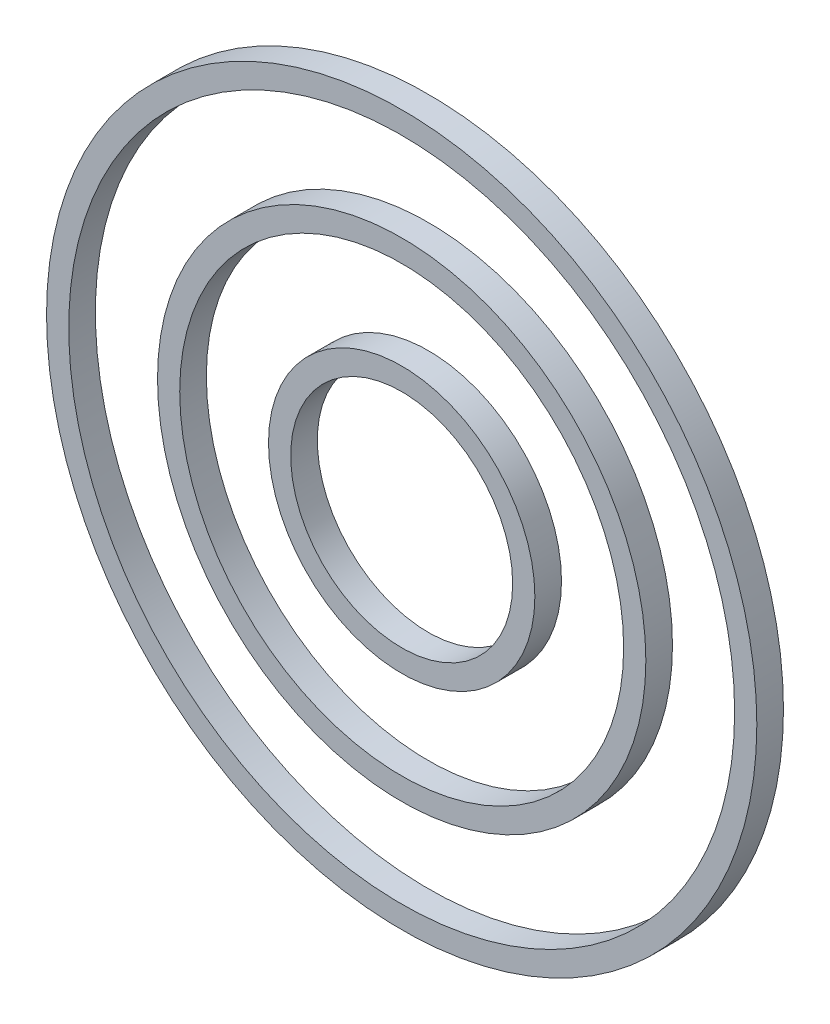
from build123d import *

# Parameters (mm, degrees)
SKETCH1_R             = 40
SKETCH1_R_2           = 37.5
BOSS_EXTRUDE1_DEPTH   = 3
SKETCH1_R_3           = 27.5
SKETCH1_R_4           = 25
BOSS_EXTRUDE1_2_DEPTH = 3
SKETCH1_R_5           = 15
SKETCH1_R_6           = 12.5
BOSS_EXTRUDE1_3_DEPTH = 3


with BuildPart() as part:
    # Sketch1 → Boss-Extrude1 (new body)
    with BuildSketch(Plane.XY):
        Circle(SKETCH1_R)
        Circle(SKETCH1_R_2, mode=Mode.SUBTRACT)
    extrude(amount=BOSS_EXTRUDE1_DEPTH)


with BuildPart() as body_2:
    # Sketch1 → Boss-Extrude1 2 (new body)
    with BuildSketch(Plane.XY):
        Circle(SKETCH1_R_3)
        Circle(SKETCH1_R_4, mode=Mode.SUBTRACT)
    extrude(amount=BOSS_EXTRUDE1_2_DEPTH)


with BuildPart() as body_3:
    # Sketch1 → Boss-Extrude1 3 (new body)
    with BuildSketch(Plane.XY):
        Circle(SKETCH1_R_5)
        Circle(SKETCH1_R_6, mode=Mode.SUBTRACT)
    extrude(amount=BOSS_EXTRUDE1_3_DEPTH)


solid = Compound([part.part, body_2.part, body_3.part])
